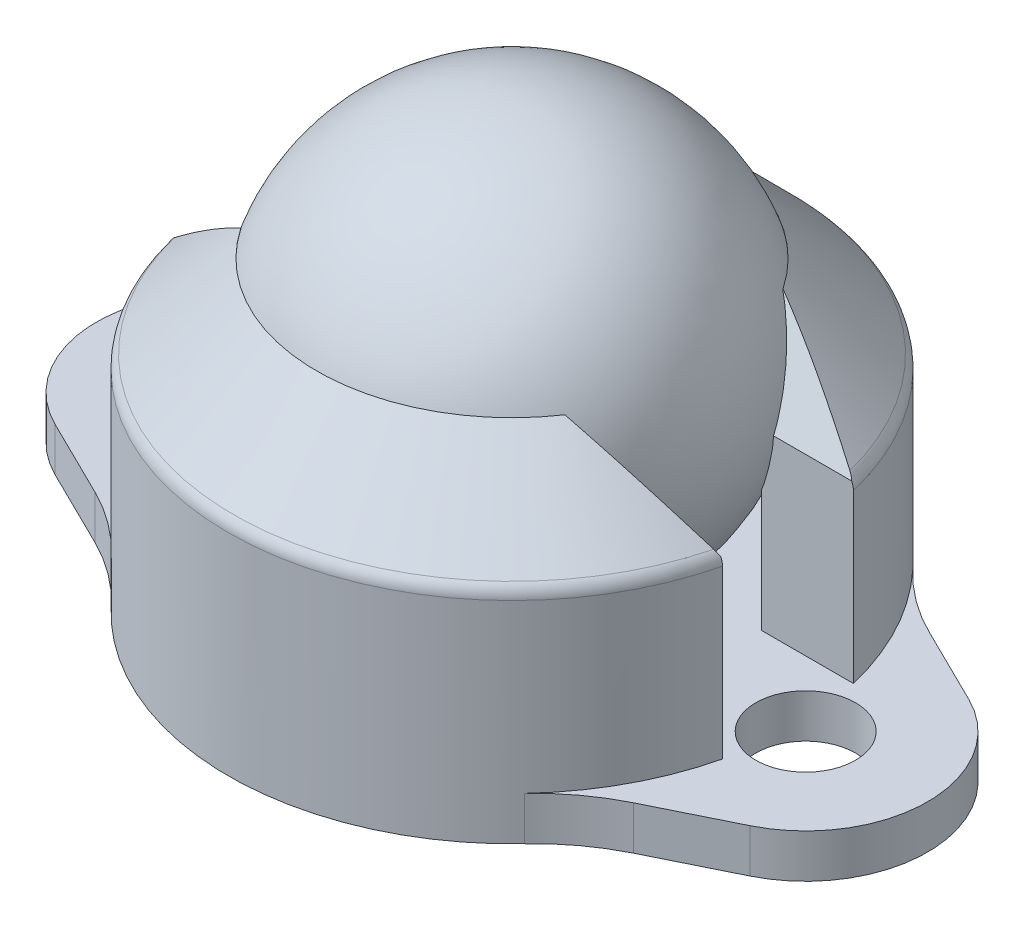
from build123d import *
from build123d.topology import SkipClean

# Parameters (mm, degrees)
SKICA1_R                      = 1.143
P_IDAT_VYSUNUT_M1_DEPTH       = 1
ODEBRAT_VYSUNUT_M1_DEPTH      = 16.368839458
ODEBRAT_VYSUNUT_M1_DEPTH_BACK = 16.368839458


with BuildPart() as part:
    # Skica1 → Přidat vysunutím1 (new body)
    with BuildSketch(Plane(origin=(0, 0, 0), x_dir=(1, 0, 0), z_dir=(0, 1, 0))):
        with BuildLine():
            Line((-7.965298969, 2.506579752), (-6.17104002, 3.390115163))
            ThreePointArc((-6.17104002, 3.390115163), (-5.406010291, 3.856296453), (-4.736453092, 4.451517956))
            ThreePointArc((-4.736453092, 4.451517956), (0, 6.5), (4.736453092, 4.451517956))
            ThreePointArc((4.736453092, 4.451517956), (5.406010291, 3.856296453), (6.17104002, 3.390115163))
            Line((6.17104002, 3.390115163), (7.965298969, 2.506579752))
            ThreePointArc((7.965298969, 2.506579752), (9.525, 0), (7.965298969, -2.506579752))
            Line((7.965298969, -2.506579752), (6.17104002, -3.390115163))
            ThreePointArc((6.17104002, -3.390115163), (5.406010291, -3.856296453), (4.736453092, -4.451517956))
            ThreePointArc((4.736453092, -4.451517956), (0, -6.5), (-4.736453092, -4.451517956))
            ThreePointArc((-4.736453092, -4.451517956), (-5.406010291, -3.856296453), (-6.17104002, -3.390115163))
            Line((-6.17104002, -3.390115163), (-7.965298969, -2.506579752))
            ThreePointArc((-7.965298969, -2.506579752), (-9.525, 0), (-7.965298969, 2.506579752))
        make_face()
        with Locations(Location((-6.731, 0, 0), (0, 0, 270))):
            Circle(SKICA1_R, mode=Mode.SUBTRACT)
        with Locations(Location((6.731, 0, 0), (0, 0, 90))):
            Circle(SKICA1_R, mode=Mode.SUBTRACT)
    extrude(amount=P_IDAT_VYSUNUT_M1_DEPTH)

    # Skica3 → Rotovat5 (revolve)
    with SkipClean():  # the faces are left unmerged after this step: merging them gives an invalid solid
        with BuildSketch(Plane(origin=(0, 0, 0), x_dir=(0, 0, -1), z_dir=(1, 0, 0))):
            with BuildLine():
                Line((6.5, 1), (6.5, 4.828823687))
                ThreePointArc((6.5, 4.828823687), (6.468238231, 4.988500884), (6.377788365, 5.123868674))
                Line((6.377788365, 5.123868674), (4.475286106, 7.026370933))
                Line((4.475286106, 7.026370933), (4.475286106, 1))
                Line((4.475286106, 1), (6.5, 1))
            make_face()
        revolve(axis=Axis((0, 0, 0), (0, 1, 0)))

    # Skica4 → Odebrat vysunutím1 (cut, two sides: drawn at the far end of the back side and taken through both)
    with SkipClean():  # the faces are left unmerged after this step: merging them gives an invalid solid
        with BuildSketch(Plane(origin=(0, 0, 0), x_dir=(0, 0, -1), z_dir=(1, 0, 0)).offset(-ODEBRAT_VYSUNUT_M1_DEPTH_BACK)):
            Polygon((-2.5, 7.026370933), (-1.5, 5), (-1.5, 1), (1.5, 1), (1.5, 5), (2.5, 7.026370933), align=None)
        extrude(amount=ODEBRAT_VYSUNUT_M1_DEPTH + ODEBRAT_VYSUNUT_M1_DEPTH_BACK, mode=Mode.SUBTRACT)


with BuildPart() as body_2:
    # Skica2 → Rotovat2 (revolve)
    with BuildSketch(Plane.XY):
        with BuildLine():
            Line((0, 10.16), (0, 0.635))
            ThreePointArc((0, 0.635), (4.7625, 5.3975), (0, 10.16))
        make_face()
    revolve(axis=Axis((0, 0, 0), (0, 1, 0)))


solid = Compound([part.part, body_2.part])
